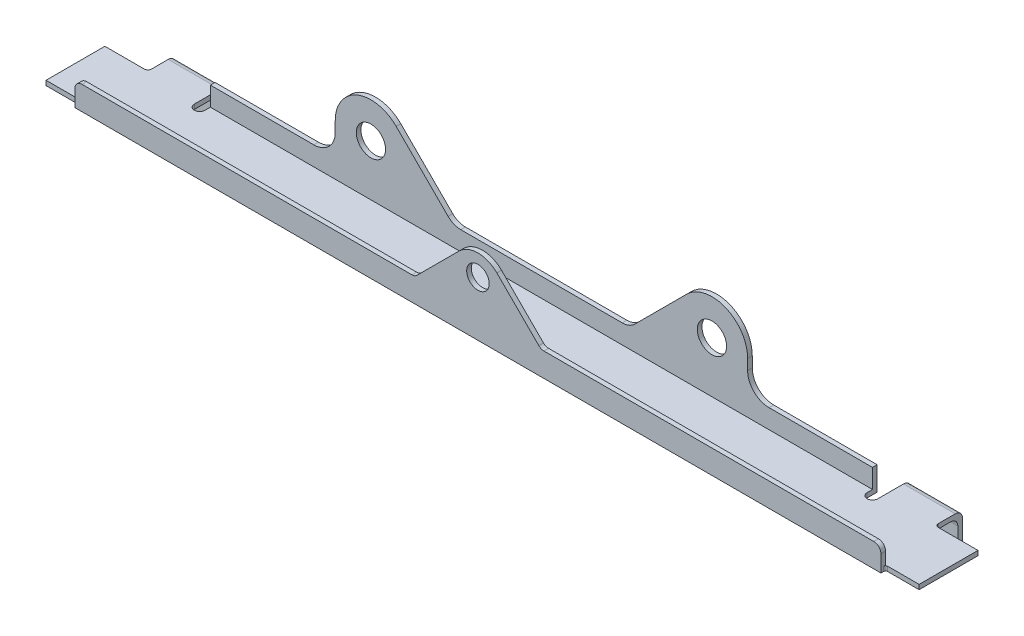
from build123d import *

# Parameters (mm, degrees)
BOSS_EXTRUDE1_DEPTH = 1.651
SKETCH2_W           = 18.415
SKETCH2_H           = 1.651
BOSS_EXTRUDE2_DEPTH = 10.287
FILLET1_R           = 2.54
FILLET3_R           = 1.27
SKETCH4_W           = 235.6739
SKETCH4_H           = 1.651
SKETCH4_W_2         = 286.8803
BOSS_EXTRUDE3_DEPTH = 30.861
SKETCH5_R           = 4.0005
CUT_EXTRUDE2_DEPTH  = 2.54
FILLET4_R           = 2.54
SKETCH11_R          = 5.207
CUT_EXTRUDE3_DEPTH  = 7.62


with BuildPart() as part:
    # Sketch1 → Boss-Extrude1 (new body)
    with BuildSketch(Plane(origin=(0, 0, 0), x_dir=(1, 0, 0), z_dir=(0, 1, 0))):
        with BuildLine():
            Line((117.83695, 8.5725), (117.83695, 12.1285))
            Line((117.83695, 12.1285), (117.186124302, 12.1285))
            Line((117.186124302, 12.1285), (-117.186124302, 12.1285))
            Line((-117.186124302, 12.1285), (-117.83695, 12.1285))
            Line((-117.83695, 12.1285), (-117.83695, 8.5725))
            ThreePointArc((-117.83695, 8.5725), (-119.74195, 6.6675), (-121.64695, 8.5725))
            Line((-121.64695, 8.5725), (-121.64695, 12.1285))
            Line((-121.64695, 12.1285), (-121.64695, 20.2565))
            Line((-121.64695, 20.2565), (-140.06195, 20.2565))
            Line((-140.06195, 20.2565), (-140.06195, 12.1285))
            Line((-140.06195, 12.1285), (-140.06195, 11.7475))
            ThreePointArc((-140.06195, 11.7475), (-140.433924388, 10.849474388), (-141.33195, 10.4775))
            Line((-141.33195, 10.4775), (-143.44015, 10.4775))
            Line((-143.44015, 10.4775), (-155.37815, 10.4775))
            Line((-155.37815, 10.4775), (-155.37815, -10.4775))
            Line((-155.37815, -10.4775), (-144.20215, -10.4775))
            ThreePointArc((-144.20215, -10.4775), (-143.663334633, -10.700684633), (-143.44015, -11.2395))
            Line((-143.44015, -11.2395), (-143.44015, -12.1285))
            Line((-143.44015, -12.1285), (143.44015, -12.1285))
            Line((143.44015, -12.1285), (143.44015, -11.2395))
            ThreePointArc((143.44015, -11.2395), (143.663334633, -10.700684633), (144.20215, -10.4775))
            Line((144.20215, -10.4775), (155.37815, -10.4775))
            Line((155.37815, -10.4775), (155.37815, 10.4775))
            Line((155.37815, 10.4775), (143.44015, 10.4775))
            Line((143.44015, 10.4775), (141.33195, 10.4775))
            ThreePointArc((141.33195, 10.4775), (140.433924388, 10.849474388), (140.06195, 11.7475))
            Line((140.06195, 11.7475), (140.06195, 12.1285))
            Line((140.06195, 12.1285), (140.06195, 20.2565))
            Line((140.06195, 20.2565), (121.64695, 20.2565))
            Line((121.64695, 20.2565), (121.64695, 12.1285))
            Line((121.64695, 12.1285), (121.64695, 8.5725))
            ThreePointArc((121.64695, 8.5725), (119.74195, 6.6675), (117.83695, 8.5725))
        make_face()
    extrude(amount=BOSS_EXTRUDE1_DEPTH)

    # Sketch2 → Boss-Extrude2 (add)
    with BuildSketch(Plane.XZ):
        with Locations((-130.85445, -19.431)):
            Rectangle(SKETCH2_W, SKETCH2_H)
        with Locations((130.85445, -19.431)):
            Rectangle(SKETCH2_W, SKETCH2_H)
    extrude(amount=BOSS_EXTRUDE2_DEPTH)

    # Fillet1
    fillet1_edges = [part.edges().sort_by_distance(p)[0] for p in [
        (130.85445, 1.651, -20.2565),
        (-130.85445, 1.651, -20.2565),
        (-130.85445, 0, -18.6055),
        (130.85445, 0, -18.6055),
    ]]
    fillet(fillet1_edges, radius=FILLET1_R)

    # Fillet3
    fillet3_edges = [part.edges().sort_by_distance(p)[0] for p in [
        (-140.06195, -10.287, -19.431),
        (-121.64695, -10.287, -19.431),
        (140.06195, -10.287, -19.431),
        (121.64695, -10.287, -19.431),
    ]]
    fillet(fillet3_edges, radius=FILLET3_R)

    # Sketch4 → Boss-Extrude3 (add)
    with BuildSketch(Plane(origin=(0, 1.651, 0), x_dir=(1, 0, 0), z_dir=(0, 1, 0))):
        with Locations((0, 11.303)):
            Rectangle(SKETCH4_W, SKETCH4_H)
        with Locations((0, -11.303)):
            Rectangle(SKETCH4_W_2, SKETCH4_H)
    extrude(amount=BOSS_EXTRUDE3_DEPTH)

    # Sketch5 → Cut-Extrude2 (cut)
    with BuildSketch(Plane.XY.offset(12.1285)):
        with Locations((0, 19.431)):
            Circle(SKETCH5_R)
        with BuildLine():
            Line((143.44015, 8.4582), (22.43455, 8.4582))
            Line((22.43455, 8.4582), (6.735192091, 24.157557909))
            ThreePointArc((6.735192091, 24.157557909), (0, 26.947365818), (-6.735192091, 24.157557909))
            Line((-6.735192091, 24.157557909), (-22.43455, 8.4582))
            Line((-22.43455, 8.4582), (-143.44015, 8.4582))
            Line((-143.44015, 8.4582), (-143.44015, 32.512))
            Line((-143.44015, 32.512), (143.44015, 32.512))
            Line((143.44015, 32.512), (143.44015, 8.4582))
        make_face()
    extrude(amount=-CUT_EXTRUDE2_DEPTH, mode=Mode.SUBTRACT)

    # Fillet4
    fillet4_edges = [part.edges().sort_by_distance(p)[0] for p in [
        (143.44015, 8.4582, 11.303),
        (22.43455, 8.4582, 11.303),
        (-22.43455, 8.4582, 11.303),
        (-143.44015, 8.4582, 11.303),
    ]]
    fillet(fillet4_edges, radius=FILLET4_R)

    # Sketch11 → Cut-Extrude3 (cut)
    with BuildSketch(Plane(origin=(0, 0, -12.1285), x_dir=(-1, 0, 0), z_dir=(0, 0, -1))):
        with Locations((60.68695, 19.812)):
            Circle(SKETCH11_R)
        with Locations((-60.68695, 19.812)):
            Circle(SKETCH11_R)
        with BuildLine():
            Line((81.00695, 8.4582), (117.83695, 8.4582))
            Line((117.83695, 8.4582), (117.83695, 32.512))
            Line((117.83695, 32.512), (60.68695, 32.512))
            ThreePointArc((60.68695, 32.512), (69.667206121, 28.792256121), (73.38695, 19.812))
            Line((73.38695, 19.812), (73.38695, 16.0782))
            ThreePointArc((73.38695, 16.0782), (75.618796327, 10.690046327), (81.00695, 8.4582))
        make_face()
        with BuildLine():
            Line((-28.742381637, 8.4582), (0, 8.4582))
            Line((0, 8.4582), (28.742381637, 8.4582))
            ThreePointArc((28.742381637, 8.4582), (31.172421432, 8.941564969), (33.232509697, 10.318071939))
            Line((33.232509697, 10.318071939), (51.706693879, 28.792256121))
            ThreePointArc((51.706693879, 28.792256121), (55.826870409, 31.545270063), (60.68695, 32.512))
            Line((60.68695, 32.512), (-60.68695, 32.512))
            ThreePointArc((-60.68695, 32.512), (-55.826870409, 31.545270063), (-51.706693879, 28.792256121))
            Line((-51.706693879, 28.792256121), (-33.232509697, 10.318071939))
            ThreePointArc((-33.232509697, 10.318071939), (-31.172421432, 8.941564969), (-28.742381637, 8.4582))
        make_face()
        with BuildLine():
            Line((-117.83695, 32.512), (-117.83695, 8.4582))
            Line((-117.83695, 8.4582), (-81.00695, 8.4582))
            ThreePointArc((-81.00695, 8.4582), (-75.618796327, 10.690046327), (-73.38695, 16.0782))
            Line((-73.38695, 16.0782), (-73.38695, 19.812))
            ThreePointArc((-73.38695, 19.812), (-69.667206121, 28.792256121), (-60.68695, 32.512))
            Line((-60.68695, 32.512), (-117.83695, 32.512))
        make_face()
    extrude(amount=-CUT_EXTRUDE3_DEPTH, mode=Mode.SUBTRACT)


solid = part.part
